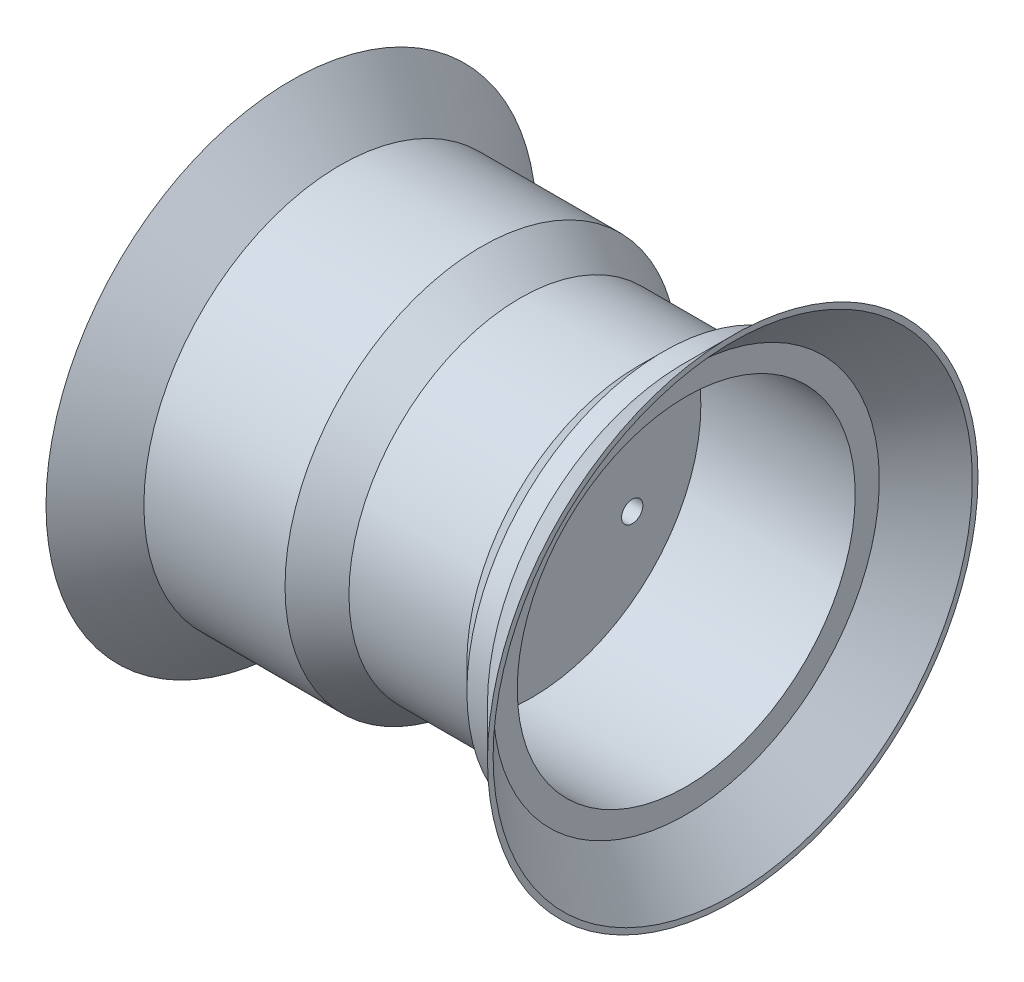
from build123d import *

# Parameters (mm, degrees)
SKETCH3_R          = 50
CUT_EXTRUDE1_DEPTH = 48
SKETCH4_R          = 43.75
CUT_EXTRUDE2_DEPTH = 52
CUT_EXTRUDE3_START = -10
SKETCH7_R          = 43.75
CUT_EXTRUDE3_DEPTH = 10
SKETCH8_R          = 11.625
SKETCH8_R_2        = 2.75
CUT_EXTRUDE4_DEPTH = 10


with BuildPart() as part:
    # Sketch2 → Revolve1 (revolve)
    with BuildSketch(Plane.XY, mode=Mode.PRIVATE) as revolve1_sk:
        Polygon((0, 0), (0, 63.5), (12.671353519, 50.828646481), (49.214586006, 50.828646481), (59.270211662, 44.337039427), (89.802920415, 44.337039427), (96.294527469, 50.828646481), (101.628646481, 50.828646481), (114.3, 63.5), (114.3, 0), align=None)
    revolve(revolve1_sk.sketch.rotate(Axis((0, 0, 0), (1, 0, 0)), 90), axis=Axis((0, 0, 0), (1, 0, 0)))

    # Sketch3 → Cut-Extrude1 (cut)
    with BuildSketch(Plane.ZY):
        Circle(SKETCH3_R)
    extrude(amount=-CUT_EXTRUDE1_DEPTH, mode=Mode.SUBTRACT)

    # Sketch4 → Cut-Extrude2 (cut)
    with BuildSketch(Plane(origin=(114.3, 0, 0), x_dir=(0, 0, -1), z_dir=(1, 0, 0))):
        Circle(SKETCH4_R)
    extrude(amount=-CUT_EXTRUDE2_DEPTH, mode=Mode.SUBTRACT)

    # Sketch5 → Cut-Revolve1 (revolve, cut)
    with BuildSketch(Plane.XY, mode=Mode.PRIVATE) as cut_revolve1_sk:
        Polygon((12.041253289, 50), (-0.277777226, 62.319030515), (-0.277777226, 50), align=None)
        Polygon((114.577777226, 62.319030515), (114.577777226, 50), (114.577777226, 45.7969371), (114.577777226, 42.174166746), (102.258746711, 42.174166746), (102.258746711, 45.7969371), (102.258746711, 50), align=None)
    revolve(cut_revolve1_sk.sketch.rotate(Axis((0, 0, 0), (1, 0, 0)), 90), axis=Axis((0, 0, 0), (1, 0, 0)), mode=Mode.SUBTRACT)

    # Sketch6 → Cut-Revolve2 (revolve, cut)
    with BuildSketch(Plane.XY, mode=Mode.PRIVATE) as cut_revolve2_sk:
        Polygon((55.706193059, 41.74129726), (47.124944427, 41.74129726), (47.124944427, 49.73979372), align=None)
    revolve(cut_revolve2_sk.sketch.rotate(Axis((0, 0, 0), (1, 0, 0)), 90), axis=Axis((0, 0, 0), (1, 0, 0)), mode=Mode.SUBTRACT)

    # Sketch7 → Cut-Extrude3 (cut)
    with BuildSketch(Plane.ZY.offset(-48).offset(CUT_EXTRUDE3_START)):
        with Locations(Location((0, 0, 0), (0, 0, 180))):
            Circle(SKETCH7_R)
    extrude(amount=CUT_EXTRUDE3_DEPTH, mode=Mode.SUBTRACT)

    # Sketch8 → Cut-Extrude4 (cut)
    with BuildSketch(Plane(origin=(62.3, 0, 0), x_dir=(0, 0, -1), z_dir=(1, 0, 0))):
        Circle(SKETCH8_R)
        with Locations((0, 30)):
            Circle(SKETCH8_R_2)
        with Locations((25.980762114, -15)):
            Circle(SKETCH8_R_2)
        with Locations((-25.980762114, -15)):
            Circle(SKETCH8_R_2)
    extrude(amount=-CUT_EXTRUDE4_DEPTH, mode=Mode.SUBTRACT)


solid = part.part
